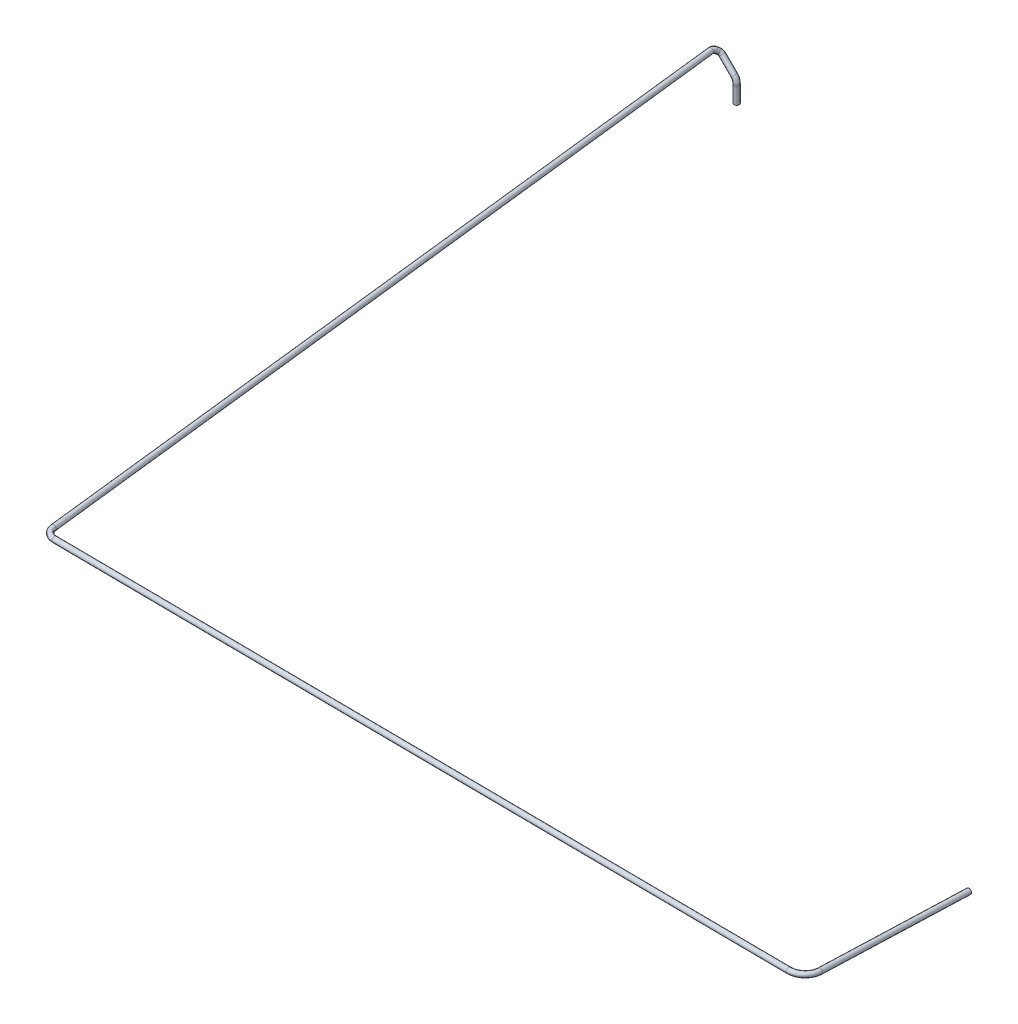
from build123d import *

# Parameters (mm, degrees)
SKETCH4_R = 0.25


with BuildPart() as part:
    # Sweep3: sweep along a curve in space
    with BuildLine() as sweep3_path:
        Line((0, 0, 0), (0, 1.544064667, 0))
        Line((0, 1.544064667, 0), (0, 1.689339828, 0))
        ThreePointArc((0, 1.689339828, 0), (-0.057090351, 1.976352402, 0), (-0.219669914, 2.219669914, 0))
        Line((-0.219669914, 2.219669914, 0), (-1.356620962, 3.356620962, 0))
        ThreePointArc((-1.356620962, 3.356620962, 0), (-1.494867959, 3.494867959, 0.03980924), (-1.611100924, 3.611100924, 0.152897858))
        Line((-1.611100924, 3.611100924, 0.152897858), (-1.703558649, 3.703558649, 0.2884697))
        ThreePointArc((-1.703558649, 3.703558649, 0.2884697), (-1.779855049, 3.784564692, 0.467759908), (-1.792653376, 3.810653106, 0.676766357))
        Line((-1.792653376, 3.810653106, 0.676766357), (5.038332118, 2.554741698, 70.464468026))
        ThreePointArc((5.038332118, 2.554741698, 70.464468026), (5.361128734, 2.541449861, 71.107081324), (6.031789132, 2.53248747, 71.366812889))
        Line((6.031789132, 2.53248747, 71.366812889), (76.481980897, 2.0622617, 71.483096204))
        ThreePointArc((76.481980897, 2.0622617, 71.483096204), (77.54159978, 2.041496645, 71.047363506), (77.984092861, 2.005456454, 69.990960492))
        Line((77.984092861, 2.005456454, 69.990960492), (78.048637233, 1.560660172, 55.793425553))
    # Sketch4 → Sweep3 (sweep)
    with BuildSketch(Plane(origin=(0, 0, 0), x_dir=(-1, 0, 0), z_dir=(0, 1, 0))):
        Circle(SKETCH4_R)
    sweep(path=sweep3_path.line)


solid = part.part
